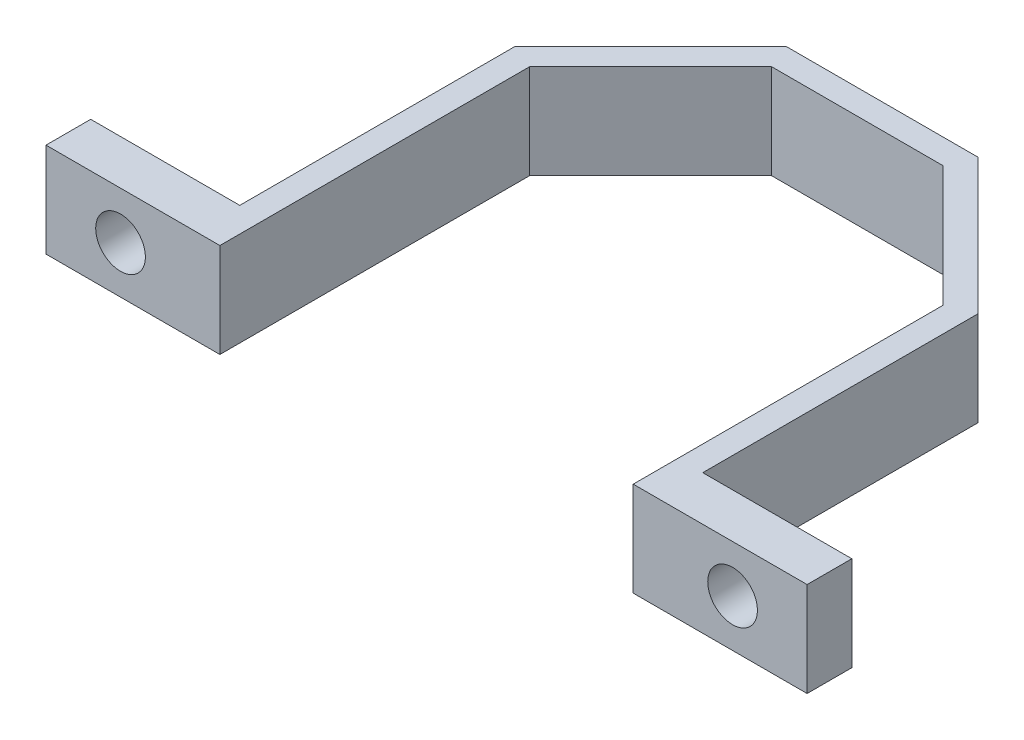
from build123d import *

# Parameters (mm, degrees)
BOSS_EXTRUDE1_DEPTH = 9.5
SKETCH3_R           = 2.5
CUT_EXTRUDE1_DEPTH  = 9.5


with BuildPart() as part:
    # Sketch2 → Boss-Extrude1 (new body)
    with BuildSketch(Plane(origin=(0, 0, 0), x_dir=(1, 0, 0), z_dir=(0, 1, 0))):
        Polygon((-9.650154056, 23.297532801), (-23.297532801, 9.650154056), (-23.297532801, -9.650154056), (-23.297532801, -18.047532806), (-38.297532801, -18.047532806), (-38.297532801, -22.547532806), (-23.297532801, -22.547532806), (-20.797532801, -22.547532806), (-20.797532801, -12.150154056), (-20.797532801, -8.61462015), (-20.797532801, 8.61462015), (-8.61462015, 20.797532801), (8.61462015, 20.797532801), (20.797532801, 8.61462015), (20.797532801, -8.61462015), (20.797532801, -12.150154056), (20.797532801, -22.547532806), (23.297532801, -22.547532806), (38.297532801, -22.547532806), (38.297532801, -18.047532806), (23.297532801, -18.047532806), (23.297532801, -9.650154056), (23.297532801, 9.650154056), (9.650154056, 23.297532801), align=None)
    extrude(amount=BOSS_EXTRUDE1_DEPTH)

    # Sketch3 → Cut-Extrude1 (cut)
    with BuildSketch(Plane(origin=(0, 0, 18.047532806), x_dir=(-1, 0, 0), z_dir=(0, 0, -1))):
        with Locations((30.797532801, 4.75)):
            Circle(SKETCH3_R)
        with Locations((-30.797532801, 4.75)):
            Circle(SKETCH3_R)
    extrude(amount=-CUT_EXTRUDE1_DEPTH, mode=Mode.SUBTRACT)


solid = part.part
